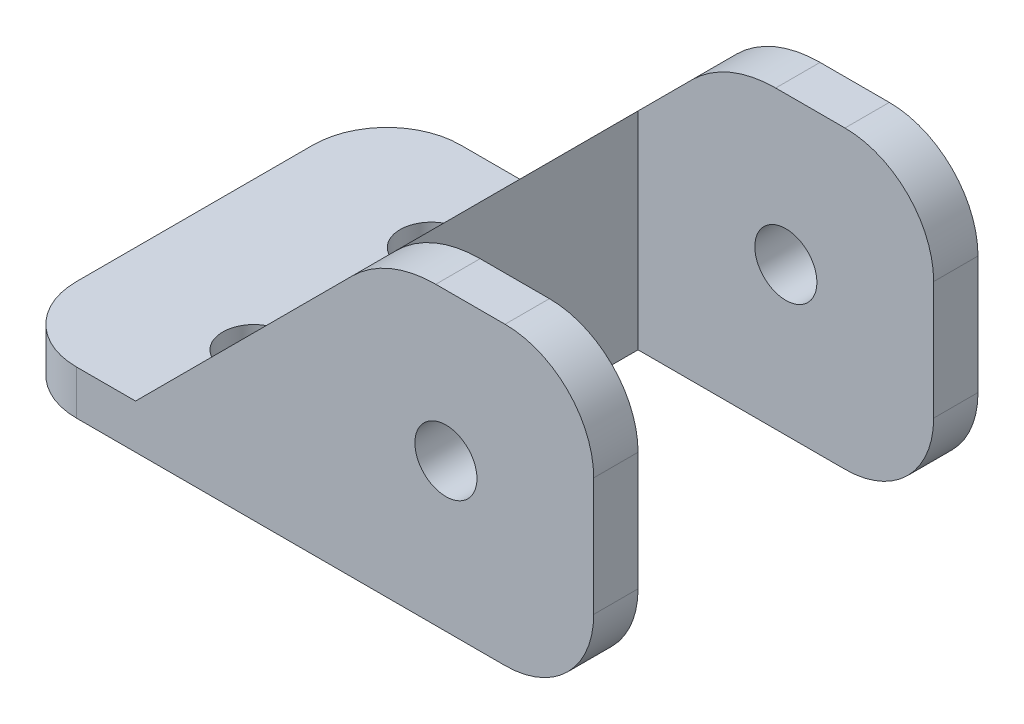
from build123d import *

# Parameters (mm, degrees)
SKETCH_1_R          = 2.1
EXTRUDE_1_DEPTH     = 3
SKETCH_3_W          = 20
SKETCH_3_H          = 3
EXTRUDE_2_DEPTH     = 20
FILLET_2_R          = 6
CHAMFER_2_SIZE      = 6
FILLET_3_R          = 8
EXTRUDE_5_DEPTH     = 26
SKETCH_12_R         = 2.1
CUT_EXTRUDE_4_DEPTH = 30
SKETCH_13_R         = 4
CUT_EXTRUDE_5_DEPTH = 30


with BuildPart() as part:
    # 草图1 → 凸台-拉伸1 (new body)
    with BuildSketch(Plane(origin=(0, 0, 0), x_dir=(1, 0, 0), z_dir=(0, 1, 0))):
        with BuildLine():
            Line((0, 0), (-15, 0))
            ThreePointArc((-15, 0), (-18.535533906, 1.464466094), (-20, 5))
            Line((-20, 5), (-20, 21))
            ThreePointArc((-20, 21), (-18.535533906, 24.535533906), (-15, 26))
            Line((-15, 26), (0, 26))
            Line((0, 26), (0, 0))
        make_face()
        with Locations(Location((-10, 19, 0), (0, 0, 270))):
            Circle(SKETCH_1_R, mode=Mode.SUBTRACT)
        with Locations(Location((-10, 7, 0), (0, 0, 270))):
            Circle(SKETCH_1_R, mode=Mode.SUBTRACT)
    extrude(amount=EXTRUDE_1_DEPTH)

    # 草图3 → 凸台-拉伸2 (add)
    with BuildSketch(Plane(origin=(0, 0, 0), x_dir=(1, 0, 0), z_dir=(0, 1, 0))):
        with Locations((10, 24.5)):
            Rectangle(SKETCH_3_W, SKETCH_3_H)
        with Locations((10, 1.5)):
            Rectangle(SKETCH_3_W, SKETCH_3_H)
    extrude(amount=EXTRUDE_2_DEPTH)

    # 圆角2
    fillet_2_edges = [part.edges().sort_by_distance(p)[0] for p in [
        (20, 0, -24.5),
        (20, 20, -24.5),
        (20, 0, -1.5),
        (20, 20, -1.5),
    ]]
    fillet(fillet_2_edges, radius=FILLET_2_R)

    # 倒角2
    chamfer_2_edges = [part.edges().sort_by_distance(p)[0] for p in [
        (0, 20, -24.5),
        (0, 20, -1.5),
    ]]
    chamfer(chamfer_2_edges, length=CHAMFER_2_SIZE)

    # 圆角3
    fillet_3_edges = [part.edges().sort_by_distance(p)[0] for p in [
        (6, 20, -1.5),
        (6, 20, -24.5),
    ]]
    fillet(fillet_3_edges, radius=FILLET_3_R)

    # 草图8 → 凸台-拉伸5 (add)
    with BuildSketch(Plane(origin=(0, 0, -26), x_dir=(-1, 0, 0), z_dir=(0, 0, -1))):
        Polygon((0, 14), (11, 3), (0, 3), align=None)
    extrude(amount=-EXTRUDE_5_DEPTH)

    # 草图12 → 切除-拉伸4 (cut)
    with BuildSketch(Plane.XY):
        with Locations((10, 10)):
            Circle(SKETCH_12_R)
    extrude(amount=-CUT_EXTRUDE_4_DEPTH, mode=Mode.SUBTRACT)

    # 草图13 → 切除-拉伸5 (cut)
    with BuildSketch(Plane(origin=(0, 3, 0), x_dir=(1, 0, 0), z_dir=(0, 1, 0))):
        with Locations((-10, 19)):
            Circle(SKETCH_13_R)
        with Locations((-10, 7)):
            Circle(SKETCH_13_R)
    extrude(amount=CUT_EXTRUDE_5_DEPTH, mode=Mode.SUBTRACT)


solid = part.part
